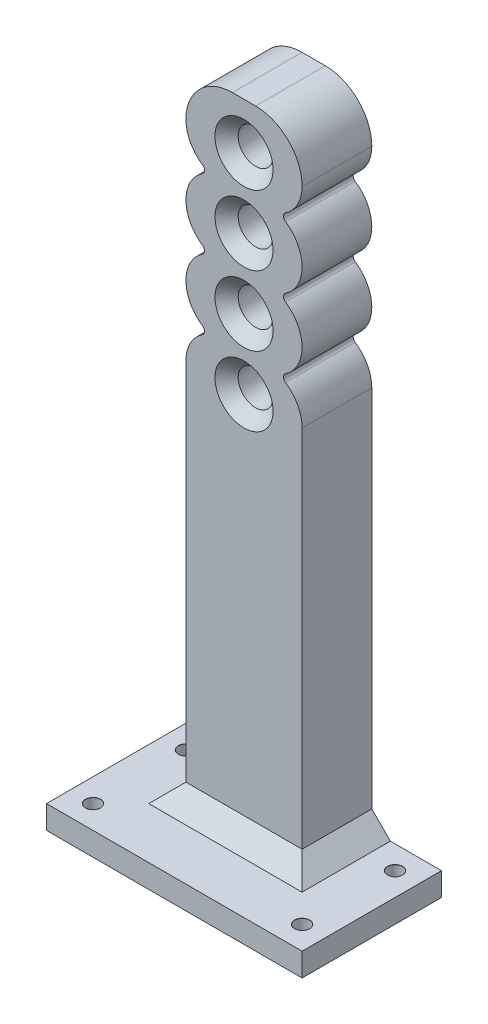
from build123d import *

# Parameters (mm, degrees)
SKETCH1_R                            = 3.75
BOSS_EXTRUDE1_DEPTH                  = 15
SKETCH2_W                            = 55
SKETCH2_H                            = 5
BOSS_EXTRUDE2_DEPTH                  = 30
F_3_2_3_2_DIAMETER_HOLE1_D           = 3.2
F_3_2_3_2_DIAMETER_HOLE1_CSINK_D     = 3.25
F_3_2_3_2_DIAMETER_HOLE1_CSINK_ANGLE = 90
CHAMFER1_SIZE                        = 4
CUT_EXTRUDE1_DEPTH                   = 146.902364614
CUT_EXTRUDE1_DEPTH_BACK              = 146.902364614
CHAMFER2_SIZE                        = 2.5


with BuildPart() as part:
    # Sketch1 → Boss-Extrude1 (new body)
    with BuildSketch(Plane.XY):
        Polygon((0, 0), (-12.5, 0), (-12.5, 142.5), (12.5, 142.5), (12.5, 0), align=None)
        with Locations((0, 132.5)):
            Circle(SKETCH1_R, mode=Mode.SUBTRACT)
        with Locations((0, 117.5)):
            Circle(SKETCH1_R, mode=Mode.SUBTRACT)
        with Locations((0, 102.5)):
            Circle(SKETCH1_R, mode=Mode.SUBTRACT)
        with Locations((0, 87.5)):
            Circle(SKETCH1_R, mode=Mode.SUBTRACT)
    extrude(amount=BOSS_EXTRUDE1_DEPTH)

    # Sketch2 → Boss-Extrude2 (add)
    with BuildSketch(Plane(origin=(0, 0, 0), x_dir=(-1, 0, 0), z_dir=(0, 0, -1))):
        with Locations((0, 2.5)):
            Rectangle(SKETCH2_W, SKETCH2_H)
    extrude(amount=-BOSS_EXTRUDE2_DEPTH)

    # Ø3.2 (3.2) Diameter Hole1 (through all)
    with Locations(Plane(origin=(0, 5, 0), x_dir=(1, 0, 0), z_dir=(0, 1, 0))):
        with Locations((-22.5, -5), (-22.5, -25), (22.5, -25), (22.5, -5)):
            CounterSinkHole(F_3_2_3_2_DIAMETER_HOLE1_D / 2, F_3_2_3_2_DIAMETER_HOLE1_CSINK_D / 2, counter_sink_angle=F_3_2_3_2_DIAMETER_HOLE1_CSINK_ANGLE)

    # Chamfer1
    chamfer1_edges = [part.edges().sort_by_distance(p)[0] for p in [
        (-12.5, 5, 7.5),
        (0, 5, 15),
        (12.5, 5, 7.5),
    ]]
    chamfer(chamfer1_edges, length=CHAMFER1_SIZE)

    # Sketch6 → Cut-Extrude1 (cut, two sides: drawn at the far end of the back side and taken through both)
    with BuildSketch(Plane.XY.offset(15).offset(-CUT_EXTRUDE1_DEPTH_BACK)):
        with BuildLine():
            ThreePointArc((-8.942906574, 110.830449827), (-11.555147059, 113.720588235), (-12.5, 117.5))
            Line((-12.5, 117.5), (-12.5, 102.5))
            ThreePointArc((-12.5, 102.5), (-11.555147059, 106.279411765), (-8.942906574, 109.169550173))
            ThreePointArc((-8.942906574, 109.169550173), (-8.5, 110), (-8.942906574, 110.830449827))
        make_face()
        with BuildLine():
            Line((12.5, 87.5), (12.5, 102.5))
            ThreePointArc((12.5, 102.5), (11.555147059, 98.720588235), (8.942906574, 95.830449827))
            ThreePointArc((8.942906574, 95.830449827), (8.5, 95), (8.942906574, 94.169550173))
            ThreePointArc((8.942906574, 94.169550173), (11.555147059, 91.279411765), (12.5, 87.5))
        make_face()
        with BuildLine():
            Line((12.5, 102.5), (12.5, 117.5))
            ThreePointArc((12.5, 117.5), (11.555147059, 113.720588235), (8.942906574, 110.830449827))
            ThreePointArc((8.942906574, 110.830449827), (8.5, 110), (8.942906574, 109.169550173))
            ThreePointArc((8.942906574, 109.169550173), (11.555147059, 106.279411765), (12.5, 102.5))
        make_face()
        with BuildLine():
            Line((12.5, 117.5), (12.5, 132.5))
            ThreePointArc((12.5, 132.5), (11.555147059, 128.720588235), (8.942906574, 125.830449827))
            ThreePointArc((8.942906574, 125.830449827), (8.5, 125), (8.942906574, 124.169550173))
            ThreePointArc((8.942906574, 124.169550173), (11.555147059, 121.279411765), (12.5, 117.5))
        make_face()
        with BuildLine():
            Line((12.5, 142.5), (2.5, 142.5))
            ThreePointArc((2.5, 142.5), (9.571067812, 139.571067812), (12.5, 132.5))
            Line((12.5, 132.5), (12.5, 142.5))
        make_face()
        with BuildLine():
            Line((-12.5, 142.5), (-12.5, 132.5))
            ThreePointArc((-12.5, 132.5), (-9.571067812, 139.571067812), (-2.5, 142.5))
            Line((-2.5, 142.5), (-12.5, 142.5))
        make_face()
        with BuildLine():
            ThreePointArc((-8.942906574, 125.830449827), (-11.555147059, 128.720588235), (-12.5, 132.5))
            Line((-12.5, 132.5), (-12.5, 117.5))
            ThreePointArc((-12.5, 117.5), (-11.555147059, 121.279411765), (-8.942906574, 124.169550173))
            ThreePointArc((-8.942906574, 124.169550173), (-8.5, 125), (-8.942906574, 125.830449827))
        make_face()
        with BuildLine():
            Line((-12.5, 102.5), (-12.5, 87.5))
            ThreePointArc((-12.5, 87.5), (-11.555147059, 91.279411765), (-8.942906574, 94.169550173))
            ThreePointArc((-8.942906574, 94.169550173), (-8.5, 95), (-8.942906574, 95.830449827))
            ThreePointArc((-8.942906574, 95.830449827), (-11.555147059, 98.720588235), (-12.5, 102.5))
        make_face()
    extrude(amount=CUT_EXTRUDE1_DEPTH + CUT_EXTRUDE1_DEPTH_BACK, mode=Mode.SUBTRACT)

    # Chamfer2
    chamfer2_edges = [part.edges().sort_by_distance(p)[0] for p in [
        (-3.75, 117.5, 15),
        (-3.75, 102.5, 15),
        (-3.75, 132.5, 15),
        (-3.75, 87.5, 15),
    ]]
    chamfer(chamfer2_edges, length=CHAMFER2_SIZE)


solid = part.part
